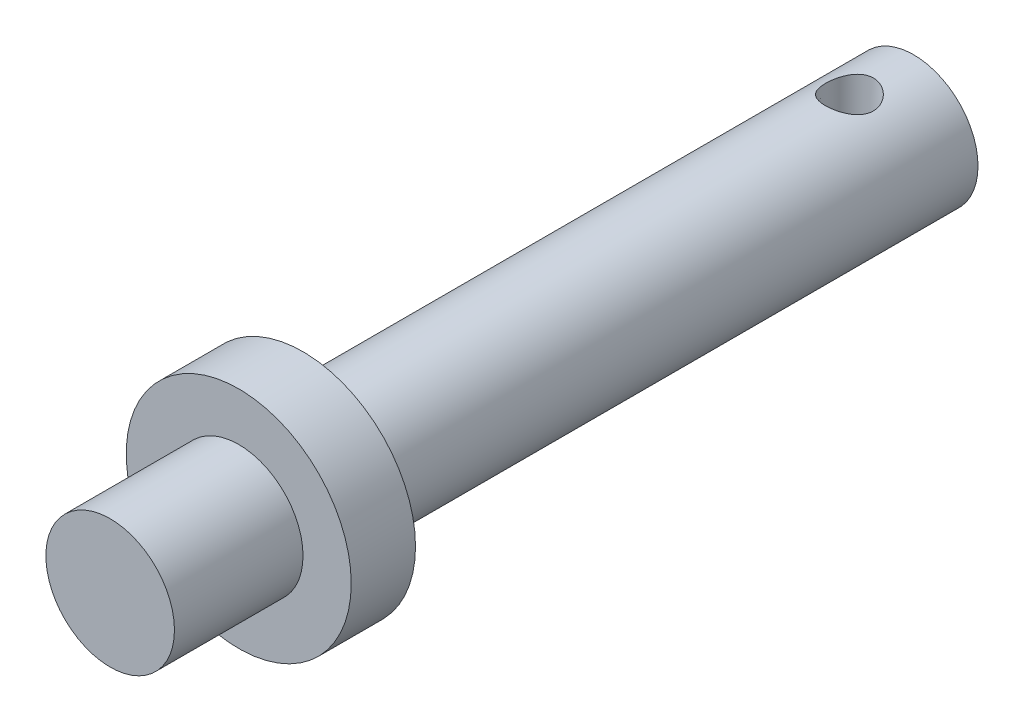
from build123d import *

# Parameters (mm, degrees)
SKETCH_1_R      = 4
EXTRUDE_1_DEPTH = 50
EXTRUDE_START   = -8
SKETCH_2_R      = 7
EXTRUDE_2_DEPTH = 4


with BuildPart() as part:
    # 草图1 → 凸台-拉伸1 (new body)
    with BuildSketch(Plane.XY):
        Circle(SKETCH_1_R)
    extrude(amount=EXTRUDE_1_DEPTH)

    # 草图2 → 凸台-拉伸2 (add)
    with BuildSketch(Plane.XY.offset(50).offset(EXTRUDE_START)):
        Circle(SKETCH_2_R)
    extrude(amount=-EXTRUDE_2_DEPTH)

    # 草图4 → 切除-旋转1 (revolve, cut)
    with BuildSketch(Plane(origin=(0, 0, 0), x_dir=(0, 0, -1), z_dir=(1, 0, 0)), mode=Mode.PRIVATE) as cut_revolve_1_sk:
        Polygon((-2.6, -4.84176312), (-4, -4.84176312), (-4, 4.751502862), (-2.5, 4.751502862), align=None)
    revolve(cut_revolve_1_sk.sketch.rotate(Axis((0, 6.786956164, 4), (0, -1, 0)), 311.656275419), axis=Axis((0, 6.786956164, 4), (0, -1, 0)), mode=Mode.SUBTRACT)


solid = part.part
